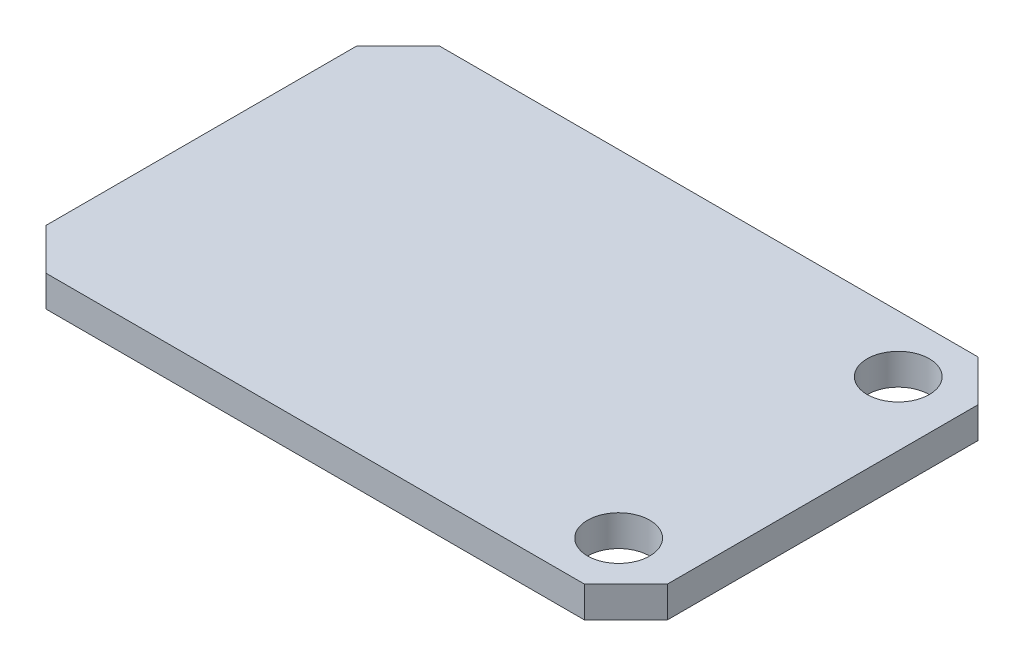
from build123d import *

# Parameters (mm, degrees)
SKETCH_1_W      = 30
SKETCH_1_H      = 19
SKETCH_1_R      = 1.5
EXTRUDE_1_DEPTH = 1.5
CHAMFER_1_SIZE  = 2


with BuildPart() as part:
    # Эскиз1 → Бобышка-Вытянуть1 (new body)
    with BuildSketch(Plane(origin=(0, 0, 0), x_dir=(1, 0, 0), z_dir=(0, 1, 0))):
        Rectangle(SKETCH_1_W, SKETCH_1_H)
        with Locations(Location((11.9, 6.75, 0), (0, 0, 270))):
            Circle(SKETCH_1_R, mode=Mode.SUBTRACT)
        with Locations(Location((11.9, -6.75, 0), (0, 0, 270))):
            Circle(SKETCH_1_R, mode=Mode.SUBTRACT)
    extrude(amount=EXTRUDE_1_DEPTH)

    # Фаска1
    chamfer_1_edges = [part.edges().sort_by_distance(p)[0] for p in [
        (-15, 0.75, -9.5),
        (15, 0.75, -9.5),
        (15, 0.75, 9.5),
        (-15, 0.75, 9.5),
    ]]
    chamfer(chamfer_1_edges, length=CHAMFER_1_SIZE)


solid = part.part
